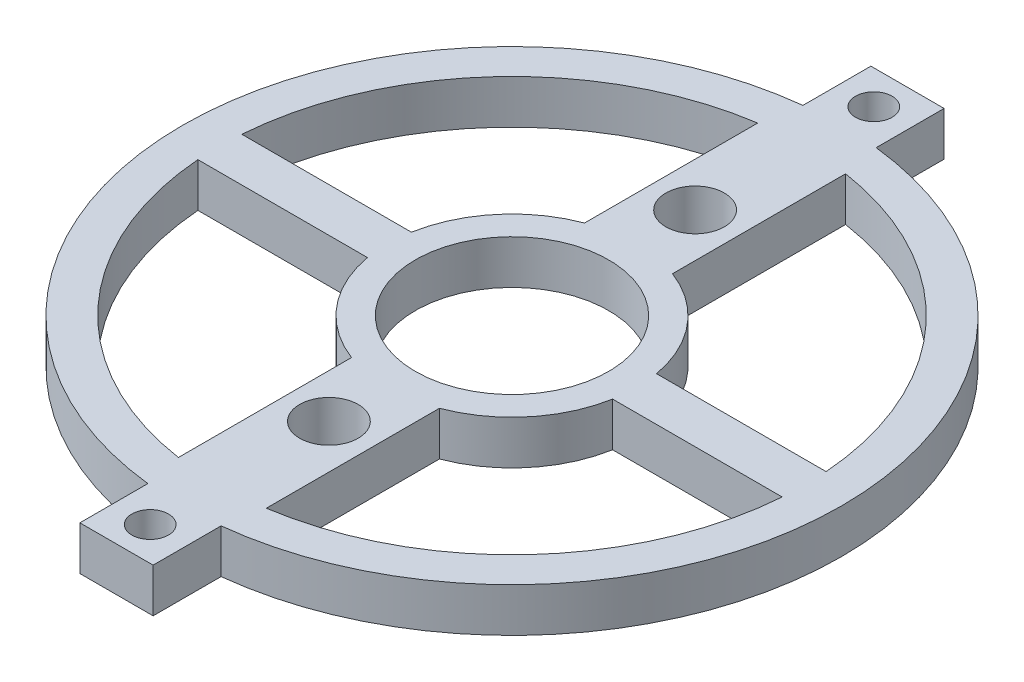
from build123d import *

# Parameters (mm, degrees)
SKETCH1_R           = 22.5
SKETCH1_R_2         = 20
BOSS_EXTRUDE1_DEPTH = 3
SKETCH2_R           = 1.25
BOSS_EXTRUDE2_DEPTH = 3
CIRPATTERN1_COUNT   = 2
SKETCH3_R           = 6.6
BOSS_EXTRUDE3_DEPTH = 3
SKETCH4_R           = 2
CUT_EXTRUDE1_DEPTH  = 3


with BuildPart() as part:
    # Sketch1 → Boss-Extrude1 (new body)
    with BuildSketch(Plane(origin=(0, 0, 0), x_dir=(1, 0, 0), z_dir=(0, 1, 0))):
        with Locations(Location((0, 0, 0), (0, 0, 270))):
            Circle(SKETCH1_R)
        with Locations(Location((0, 0, 0), (0, 0, 270))):
            Circle(SKETCH1_R_2, mode=Mode.SUBTRACT)
    extrude(amount=BOSS_EXTRUDE1_DEPTH)

    # Sketch2 → Boss-Extrude2 (add)
    with BuildSketch(Plane(origin=(0, 0, 0), x_dir=(1, 0, 0), z_dir=(0, 1, 0))):
        with BuildLine():
            Line((-2.5, 27), (2.5, 27))
            Line((2.5, 27), (2.5, 22.360679775))
            ThreePointArc((2.5, 22.360679775), (0, 22.5), (-2.5, 22.360679775))
            Line((-2.5, 22.360679775), (-2.5, 27))
        make_face()
        with Locations(Location((0, 24.7, 0), (0, 0, 270))):
            Circle(SKETCH2_R, mode=Mode.SUBTRACT)
    boss_extrude2 = extrude(amount=BOSS_EXTRUDE2_DEPTH)

    # CirPattern1: Boss-Extrude2 ×2 about axis
    cirpattern1_axis = Axis((0, 0, 0), (0, 1, 0))
    for i in range(1, CIRPATTERN1_COUNT):
        add(boss_extrude2.rotate(cirpattern1_axis, i * 360 / CIRPATTERN1_COUNT))

    # Sketch3 → Boss-Extrude3 (add)
    with BuildSketch(Plane(origin=(0, 0, 0), x_dir=(1, 0, 0), z_dir=(0, 1, 0))):
        with BuildLine():
            Line((-3, 19.773719933), (-3, 7.95298686))
            ThreePointArc((-3, 7.95298686), (-6.535301084, 5.435056554), (-8.366600265, 1.5))
            Line((-8.366600265, 1.5), (-19.943670675, 1.5))
            ThreePointArc((-19.943670675, 1.5), (-20, 0), (-19.943670675, -1.5))
            Line((-19.943670675, -1.5), (-8.366600265, -1.5))
            ThreePointArc((-8.366600265, -1.5), (-6.535301084, -5.435056554), (-3, -7.95298686))
            Line((-3, -7.95298686), (-3, -19.773719933))
            ThreePointArc((-3, -19.773719933), (0, -20), (3, -19.773719933))
            Line((3, -19.773719933), (3, -7.95298686))
            ThreePointArc((3, -7.95298686), (6.535301084, -5.435056554), (8.366600265, -1.5))
            Line((8.366600265, -1.5), (19.943670675, -1.5))
            ThreePointArc((19.943670675, -1.5), (20, 0), (19.943670675, 1.5))
            Line((19.943670675, 1.5), (8.366600265, 1.5))
            ThreePointArc((8.366600265, 1.5), (6.535301084, 5.435056554), (3, 7.95298686))
            Line((3, 7.95298686), (3, 19.773719933))
            ThreePointArc((3, 19.773719933), (0, 20), (-3, 19.773719933))
        make_face()
        with Locations(Location((0, 0, 0), (0, 0, 270))):
            Circle(SKETCH3_R, mode=Mode.SUBTRACT)
    extrude(amount=BOSS_EXTRUDE3_DEPTH)

    # Sketch4 → Cut-Extrude1 (cut)
    with BuildSketch(Plane(origin=(0, 3, 0), x_dir=(1, 0, 0), z_dir=(0, 1, 0))):
        with Locations(Location((0, 12.5, 0), (0, 0, 270))):
            Circle(SKETCH4_R)
        with Locations(Location((0, -12.5, 0), (0, 0, 270))):
            Circle(SKETCH4_R)
    extrude(amount=-CUT_EXTRUDE1_DEPTH, mode=Mode.SUBTRACT)


solid = part.part
